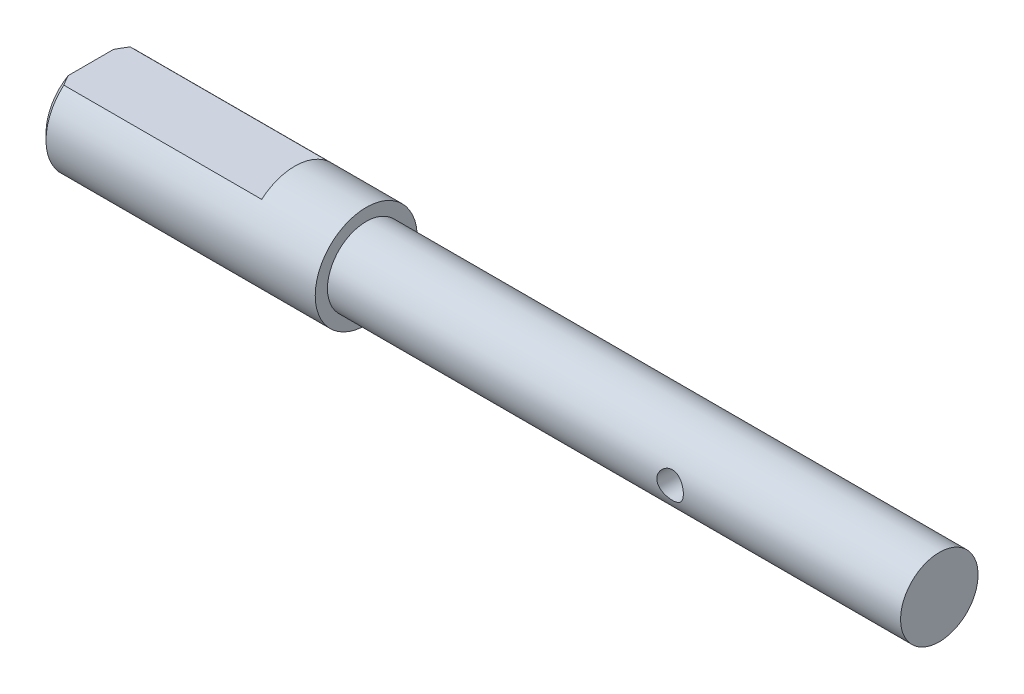
from build123d import *

# Parameters (mm, degrees)
CUT_EXTRUDE1_DEPTH      = 107.044923952
CUT_EXTRUDE1_DEPTH_BACK = 107.044923952
SKETCH2_R               = 1.651
CUT_EXTRUDE2_DEPTH      = 25.4
CHAMFER1_SIZE           = 0.762


with BuildPart() as part:
    # Sketch1 → Revolve1 (revolve)
    with BuildSketch(Plane.XY, mode=Mode.PRIVATE) as revolve1_sk:
        Polygon((0, 0), (0, 4.826), (-71.374, 4.826), (-71.374, 6.35), (-105.664, 6.35), (-105.664, 0), align=None)
    revolve(revolve1_sk.sketch.rotate(Axis((-91.219448406, 0, 0), (1, 0, 0)), 90), axis=Axis((-91.219448406, 0, 0), (1, 0, 0)))

    # Sketch2 → Cut-Extrude1 (cut, two sides: drawn at the far end of the back side and taken through both)
    with BuildSketch(Plane.XY.offset(-CUT_EXTRUDE1_DEPTH_BACK)):
        with Locations((-28.702, 0)):
            Circle(SKETCH2_R)
    extrude(amount=CUT_EXTRUDE1_DEPTH + CUT_EXTRUDE1_DEPTH_BACK, mode=Mode.SUBTRACT)

    # Sketch4 → Cut-Extrude2 (cut)
    with BuildSketch(Plane.ZY.offset(105.664)):
        with BuildLine():
            Line((-4.12701151, 4.826), (4.12701151, 4.826))
            ThreePointArc((4.12701151, 4.826), (0, 6.35), (-4.12701151, 4.826))
        make_face()
    extrude(amount=-CUT_EXTRUDE2_DEPTH, mode=Mode.SUBTRACT)

    # Chamfer1
    chamfer1_edges = [part.edges().sort_by_distance(p)[0] for p in [
        (-105.664, -5.76753947, -2.656687497),
    ]]
    chamfer(chamfer1_edges, length=CHAMFER1_SIZE)


solid = part.part
